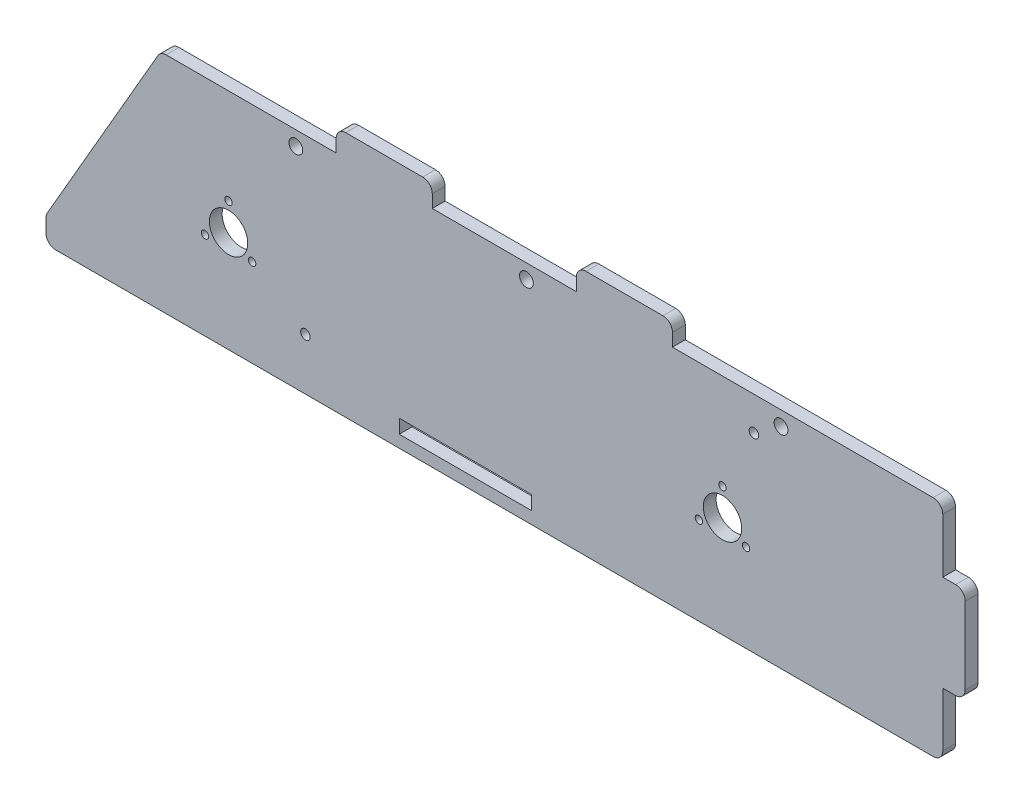
from build123d import *

# Parameters (mm, degrees)
SKETCH1_R           = 6
SKETCH1_R_2         = 1.15
SKETCH1_R_3         = 1.5
SKETCH1_R_4         = 2.15
SKETCH1_W           = 41.3
SKETCH1_H           = 4.35
BOSS_EXTRUDE1_DEPTH = 4
FILLET1_R           = 3


with BuildPart() as part:
    # Sketch1 → Boss-Extrude1 (new body)
    with BuildSketch(Plane.XY):
        Polygon((-128.17175976, -30), (151.82824024, -30), (151.82824024, -10), (158.82824024, -10), (158.82824024, 5), (158.82824024, 20), (151.82824024, 20), (151.82824024, 40), (67.43395693, 40), (67.43395693, 47), (37.43395693, 47), (37.43395693, 40), (-7.56604307, 40), (-7.56604307, 47), (-37.56604307, 47), (-37.56604307, 40), (-92.37604307, 40), (-128.17175976, -22), align=None)
        with Locations((-71.175741186, 1.72)):
            Circle(SKETCH1_R, mode=Mode.SUBTRACT)
        with Locations((-71.175741186, 10.22)):
            Circle(SKETCH1_R_2, mode=Mode.SUBTRACT)
        with Locations((-63.814525254, -2.53)):
            Circle(SKETCH1_R_2, mode=Mode.SUBTRACT)
        with Locations((-78.536957118, -2.53)):
            Circle(SKETCH1_R_2, mode=Mode.SUBTRACT)
        with Locations((83.04824024, 1.72)):
            Circle(SKETCH1_R, mode=Mode.SUBTRACT)
        with Locations((83.04824024, 10.22)):
            Circle(SKETCH1_R_2, mode=Mode.SUBTRACT)
        with Locations((90.409456172, -2.53)):
            Circle(SKETCH1_R_2, mode=Mode.SUBTRACT)
        with Locations((75.687024308, -2.53)):
            Circle(SKETCH1_R_2, mode=Mode.SUBTRACT)
        with Locations((92.86036, 29.5)):
            Circle(SKETCH1_R_3, mode=Mode.SUBTRACT)
        with Locations((-50.17175976, 35.5)):
            Circle(SKETCH1_R_4, mode=Mode.SUBTRACT)
        with Locations((21.82824024, 35.5)):
            Circle(SKETCH1_R_4, mode=Mode.SUBTRACT)
        with Locations((101.32824024, 35.5)):
            Circle(SKETCH1_R_4, mode=Mode.SUBTRACT)
        with Locations((-47.17175976, -13.85)):
            Circle(SKETCH1_R_3, mode=Mode.SUBTRACT)
        with Locations((2.77824024, -24.025)):
            Rectangle(SKETCH1_W, SKETCH1_H, mode=Mode.SUBTRACT)
    extrude(amount=BOSS_EXTRUDE1_DEPTH)

    # Fillet1
    fillet1_edges = [part.edges().sort_by_distance(p)[0] for p in [
        (-128.17175976, -22, 2),
        (-92.37604307, 40, 2),
        (-37.56604307, 47, 2),
        (-7.56604307, 47, 2),
        (37.43395693, 47, 2),
        (67.43395693, 47, 2),
        (151.82824024, 40, 2),
        (158.82824024, 20, 2),
        (158.82824024, -10, 2),
        (151.82824024, -30, 2),
        (-128.17175976, -30, 2),
    ]]
    fillet(fillet1_edges, radius=FILLET1_R)


solid = part.part
